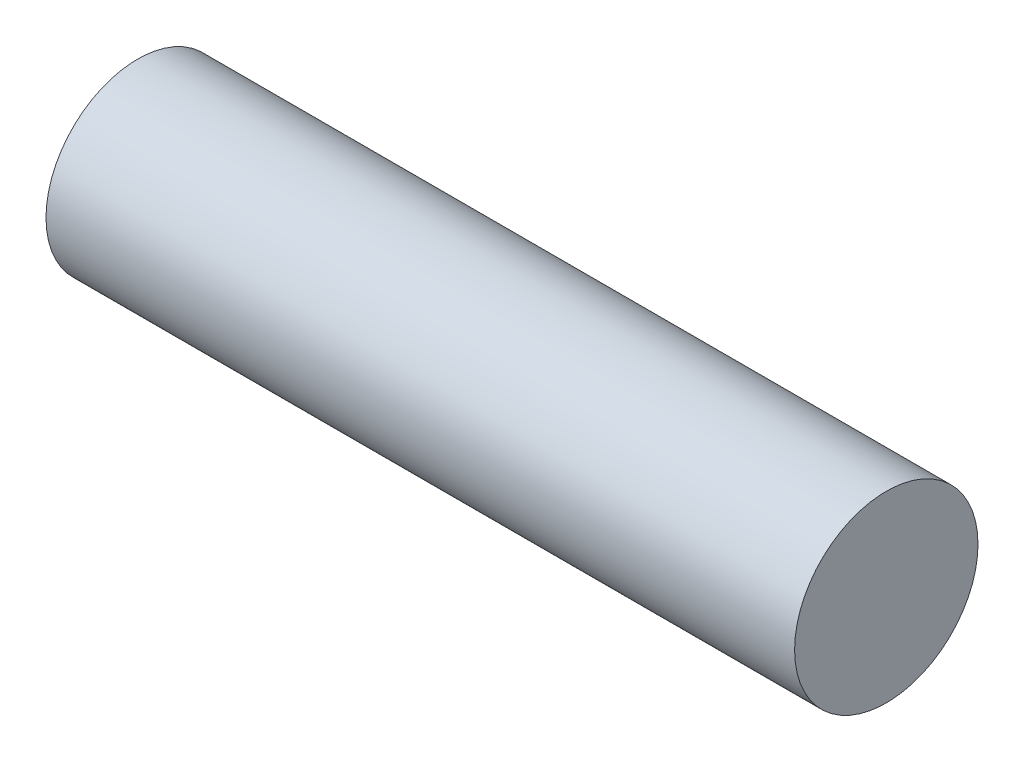
from build123d import *

# Parameters (mm, degrees)
SKETCH1_R           = 2.45
BOSS_EXTRUDE1_DEPTH = 10


with BuildPart() as part:
    # Sketch1 → Boss-Extrude1 (new, symmetric)
    with BuildSketch(Plane(origin=(0, 0, 0), x_dir=(0, 0, -1), z_dir=(1, 0, 0))):
        Circle(SKETCH1_R)
    extrude(amount=BOSS_EXTRUDE1_DEPTH, both=True)


solid = part.part
